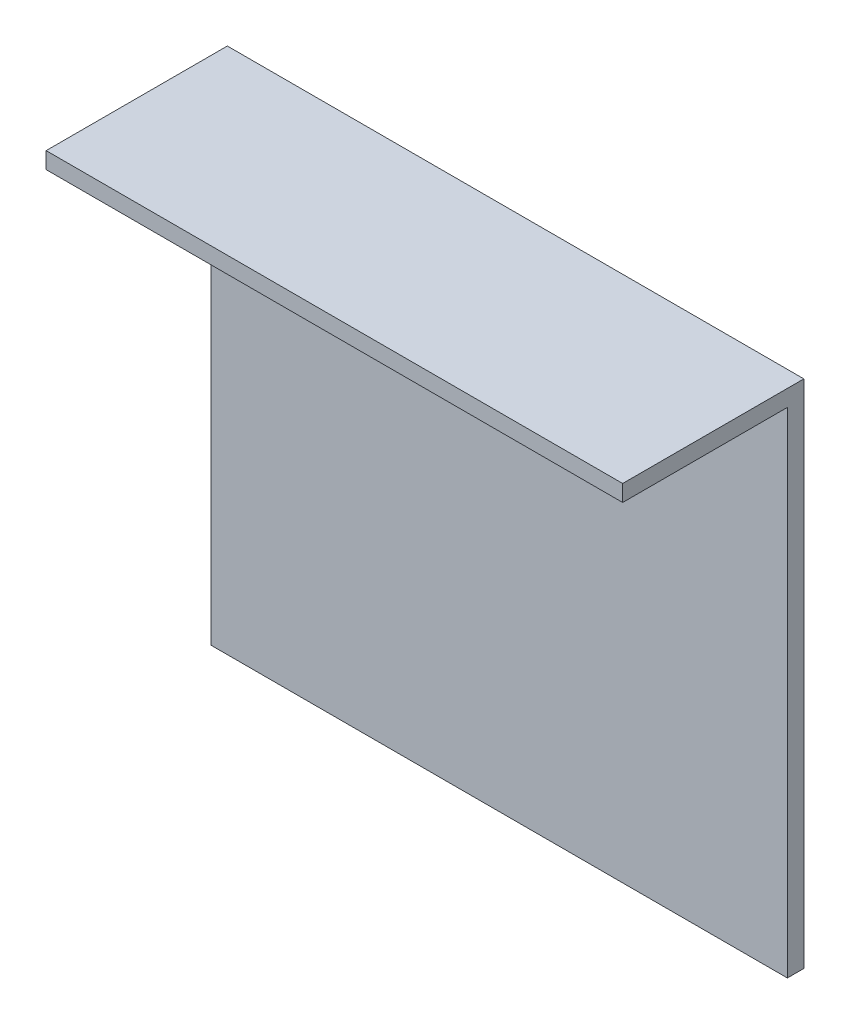
from build123d import *

# Parameters (mm, degrees)
SKETCH_1_W      = 70
SKETCH_1_H      = 62
EXTRUDE_1_DEPTH = 2
SKETCH_2_W      = 70
SKETCH_2_H      = 2
EXTRUDE_2_DEPTH = 20


with BuildPart() as part:
    # 草图1 → 凸台-拉伸1 (new body)
    with BuildSketch(Plane.XY):
        Rectangle(SKETCH_1_W, SKETCH_1_H)
    extrude(amount=EXTRUDE_1_DEPTH)

    # 草图2 → 凸台-拉伸2 (add)
    with BuildSketch(Plane.XY.offset(2)):
        with Locations((0, 30)):
            Rectangle(SKETCH_2_W, SKETCH_2_H)
    extrude(amount=EXTRUDE_2_DEPTH)


solid = part.part
